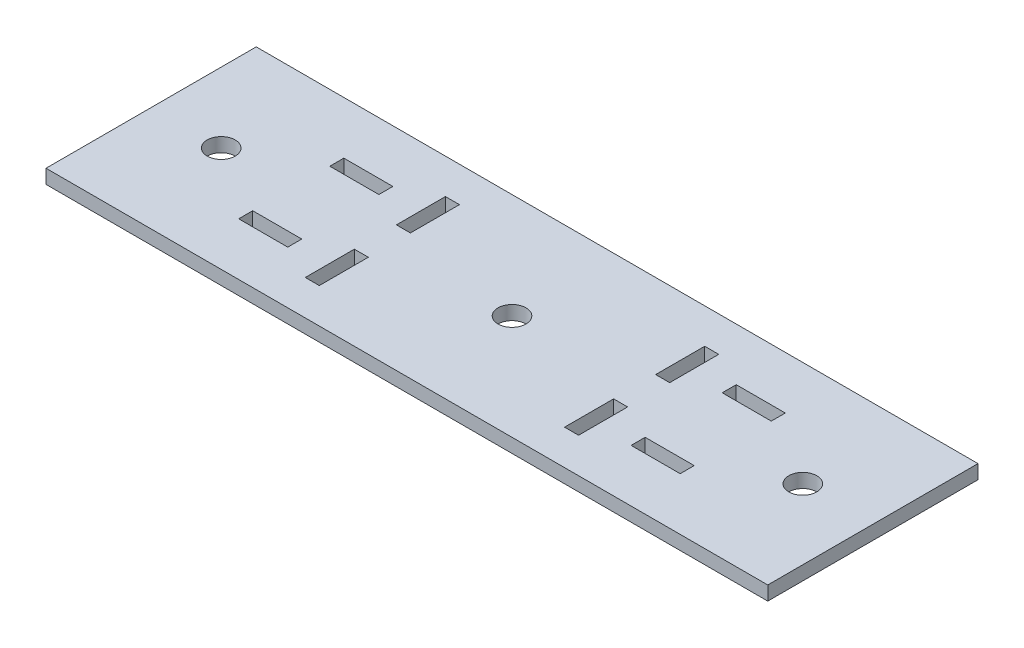
from build123d import *

# Parameters (mm, degrees)
SKETCH1_W           = 103
SKETCH1_H           = 30
SKETCH1_R           = 2
SKETCH1_W_2         = 7
SKETCH1_H_2         = 2
SKETCH1_W_3         = 2
SKETCH1_H_3         = 7
BOSS_EXTRUDE1_DEPTH = 2


with BuildPart() as part:
    # Sketch1 → Boss-Extrude1 (new body)
    with BuildSketch(Plane(origin=(0, 0, 0), x_dir=(1, 0, 0), z_dir=(0, 1, 0))):
        with Locations((-11.269774173, -8.963557039)):
            Rectangle(SKETCH1_W, SKETCH1_H)
        with Locations(Location((-52.769774173, -8.963557039, 0), (0, 0, 270))):
            Circle(SKETCH1_R, mode=Mode.SUBTRACT)
        with Locations(Location((30.230225827, -8.963557039, 0), (0, 0, 270))):
            Circle(SKETCH1_R, mode=Mode.SUBTRACT)
        with Locations(Location((-11.269774173, -8.963557039, 0), (0, 0, 270))):
            Circle(SKETCH1_R, mode=Mode.SUBTRACT)
        with Locations((-39.269774173, -15.463557039)):
            Rectangle(SKETCH1_W_2, SKETCH1_H_2, mode=Mode.SUBTRACT)
        with Locations((-39.269774173, -2.463557039)):
            Rectangle(SKETCH1_W_2, SKETCH1_H_2, mode=Mode.SUBTRACT)
        with Locations((16.730225827, -2.463557039)):
            Rectangle(SKETCH1_W_2, SKETCH1_H_2, mode=Mode.SUBTRACT)
        with Locations((16.730225827, -15.463557039)):
            Rectangle(SKETCH1_W_2, SKETCH1_H_2, mode=Mode.SUBTRACT)
        with Locations((-29.769774173, -2.463557039)):
            Rectangle(SKETCH1_W_3, SKETCH1_H_3, mode=Mode.SUBTRACT)
        with Locations((-29.769774173, -15.463557039)):
            Rectangle(SKETCH1_W_3, SKETCH1_H_3, mode=Mode.SUBTRACT)
        with Locations((7.230225827, -15.463557039)):
            Rectangle(SKETCH1_W_3, SKETCH1_H_3, mode=Mode.SUBTRACT)
        with Locations((7.230225827, -2.463557039)):
            Rectangle(SKETCH1_W_3, SKETCH1_H_3, mode=Mode.SUBTRACT)
    extrude(amount=BOSS_EXTRUDE1_DEPTH)


solid = part.part
